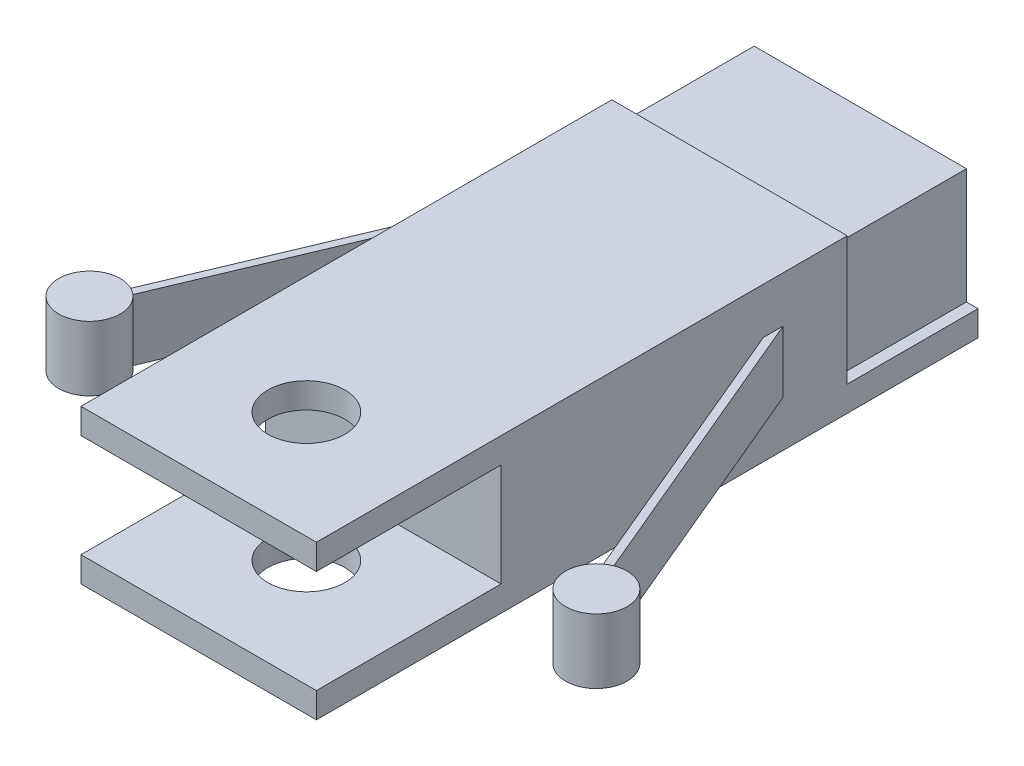
from build123d import *

# Parameters (mm, degrees)
SKETCH1_W                = 15.3
SKETCH1_H                = 43
BOSS_EXTRUDE1_DEPTH      = 10
SKETCH2_W                = 12
SKETCH2_H                = 6.7
SKETCH2_W_2              = 8.5
SKETCH2_H_2              = 8.35
CUT_EXTRUDE1_DEPTH       = 29.219496806
SKETCH3_W                = 13.8
SKETCH3_H                = 8
BOSS_EXTRUDE2_DEPTH      = 7.5
CUT_EXTRUDE2_DEPTH       = 7.5
LPATTERN1_COUNT          = 3
LPATTERN1_PITCH          = 4.433333333
BOSS_EXTRUDE3_DEPTH      = 4
BOSS_EXTRUDE4_DEPTH      = 4.1
BOSS_EXTRUDE4_DEPTH_BACK = 0.1
SKETCH7_R                = 2
SKETCH8_R                = 2.5
CUT_EXTRUDE3_DEPTH       = 31.057587225


with BuildPart() as part:
    # Sketch1 → Boss-Extrude1 (new body)
    with BuildSketch(Plane(origin=(0, 0, 0), x_dir=(1, 0, 0), z_dir=(0, 1, 0))):
        Rectangle(SKETCH1_W, SKETCH1_H)
    extrude(amount=BOSS_EXTRUDE1_DEPTH)

    # Sketch2 → Cut-Extrude1 (cut, through all)
    with BuildSketch(Plane(origin=(7.65, 0, 0), x_dir=(0, 0, -1), z_dir=(1, 0, 0))):
        with Locations((-15.5, 5)):
            Rectangle(SKETCH2_W, SKETCH2_H)
        with Locations((17.25, 5.825)):
            Rectangle(SKETCH2_W_2, SKETCH2_H_2)
    extrude(amount=-CUT_EXTRUDE1_DEPTH, mode=Mode.SUBTRACT)

    # Sketch8 → Cut-Extrude3 (cut, through all)
    with BuildSketch(Plane.XZ):
        with Locations(Location((0, 14.5, 0), (0, 0, 270))):
            Circle(SKETCH8_R)
    extrude(amount=-CUT_EXTRUDE3_DEPTH, mode=Mode.SUBTRACT)


with BuildPart() as body_2:
    # Sketch3 → Boss-Extrude2 (new body)
    with BuildSketch(Plane(origin=(0, 1.65, 0), x_dir=(1, 0, 0), z_dir=(0, 1, 0))):
        with Locations((0, 17.5)):
            Rectangle(SKETCH3_W, SKETCH3_H)
    extrude(amount=BOSS_EXTRUDE2_DEPTH)

    # Sketch4 → Cut-Extrude2 (cut)
    with BuildSketch(Plane(origin=(0, 0, -21.5), x_dir=(-1, 0, 0), z_dir=(0, 0, -1))):
        Polygon((-6.4, 1.65), (-6.4, 7.65), (-5.6, 7.65), (-6.3999967, 8.65), (-2.4666667, 8.65), (-3.2666667, 7.65), (-2.4666667, 7.65), (-2.4666667, 1.65), align=None)
    cut_extrude2 = extrude(amount=-CUT_EXTRUDE2_DEPTH, mode=Mode.SUBTRACT)

    # LPattern1: Cut-Extrude2 ×3
    with Locations(*[(-i * LPATTERN1_PITCH, 0, 0) for i in range(1, LPATTERN1_COUNT)]):
        add(cut_extrude2, mode=Mode.SUBTRACT)


with BuildPart() as body_3:
    # Sketch6 → Boss-Extrude3 (new body)
    with BuildSketch(Plane(origin=(0, 3, 0), x_dir=(1, 0, 0), z_dir=(0, 1, 0))):
        Polygon((-6.77634418, 10.917443401), (-16.471831252, -12.125940258), (-16.010963579, -12.319849999), (-6.315476506, 10.723533659), align=None)
    extrude(amount=BOSS_EXTRUDE3_DEPTH)


with BuildPart() as body_4:
    # Sketch7 → Boss-Extrude4 (new, two sides: drawn at the far end of the back side and taken through both)
    with BuildSketch(Plane(origin=(0, 3, 0), x_dir=(1, 0, 0), z_dir=(0, 1, 0)).offset(-BOSS_EXTRUDE4_DEPTH_BACK)):
        with Locations(Location((-16.471831252, -12.125940258, 0), (0, 0, 270))):
            Circle(SKETCH7_R)
    extrude(amount=BOSS_EXTRUDE4_DEPTH + BOSS_EXTRUDE4_DEPTH_BACK)


with BuildPart() as body_5:
    # Mirror1: mirrored copy
    add(body_4.part.mirror(Plane(origin=(0, 0, 0), x_dir=(0, 0, 1), z_dir=(1, 0, 0))))


with BuildPart() as body_6:
    # Mirror1 2: mirrored copy
    add(body_3.part.mirror(Plane(origin=(0, 0, 0), x_dir=(0, 0, 1), z_dir=(1, 0, 0))))


solid = Compound([part.part, body_2.part, body_3.part, body_4.part, body_5.part, body_6.part])
